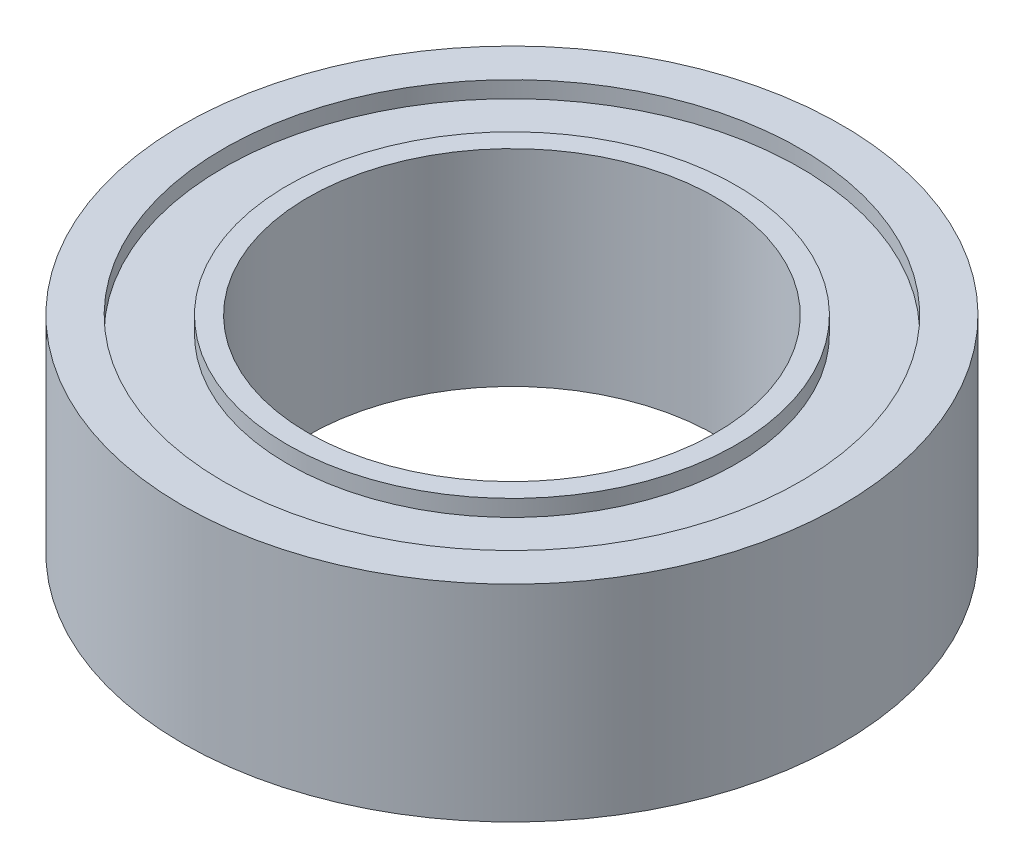
from build123d import *

# Parameters (mm, degrees)
SKETCH_1_R          = 4
SKETCH_1_R_2        = 2.475
EXTRUDE_1_DEPTH     = 2.5
SKETCH_2_R          = 3.5
SKETCH_2_R_2        = 3.2
SKETCH_2_R_3        = 2.725
CUT_EXTRUDE_1_DEPTH = 0.2
CUT_EXTRUDE_START   = -0.2
SKETCH_3_R          = 3.5
SKETCH_3_R_2        = 2.725
CUT_EXTRUDE_2_DEPTH = 0.2


with BuildPart() as part:
    # Эскиз1 → Бобышка-Вытянуть1 (new body)
    with BuildSketch(Plane(origin=(0, 0, 0), x_dir=(1, 0, 0), z_dir=(0, 1, 0))):
        with Locations(Location((0, 0, 0), (0, 0, 270))):
            Circle(SKETCH_1_R)
        with Locations(Location((0, 0, 0), (0, 0, 270))):
            Circle(SKETCH_1_R_2, mode=Mode.SUBTRACT)
    extrude(amount=EXTRUDE_1_DEPTH)

    # Эскиз2 → Вырез-Вытянуть1 (cut)
    # profile 1 of 2: a face of its own
    with BuildSketch(Plane(origin=(0, 2.5, 0), x_dir=(1, 0, 0), z_dir=(0, 1, 0))):
        with Locations(Location((0, 0, 0), (0, 0, 270))):
            Circle(SKETCH_2_R)
        Circle(SKETCH_2_R_2, mode=Mode.SUBTRACT)
    # profile 2 of 2: a face of its own
    with BuildSketch(Plane(origin=(0, 2.5, 0), x_dir=(1, 0, 0), z_dir=(0, 1, 0))):
        Circle(SKETCH_2_R_2)
        with Locations(Location((0, 0, 0), (0, 0, 270))):
            Circle(SKETCH_2_R_3, mode=Mode.SUBTRACT)
    extrude(amount=-CUT_EXTRUDE_1_DEPTH, mode=Mode.SUBTRACT)

    # Эскиз3 → Вырез-Вытянуть2 (cut)
    with BuildSketch(Plane.XZ.offset(CUT_EXTRUDE_START)):
        with Locations(Location((0, 0, 0), (0, 0, 90))):
            Circle(SKETCH_3_R)
        with Locations(Location((0, 0, 0), (0, 0, 90))):
            Circle(SKETCH_3_R_2, mode=Mode.SUBTRACT)
    extrude(amount=CUT_EXTRUDE_2_DEPTH, mode=Mode.SUBTRACT)


solid = part.part
